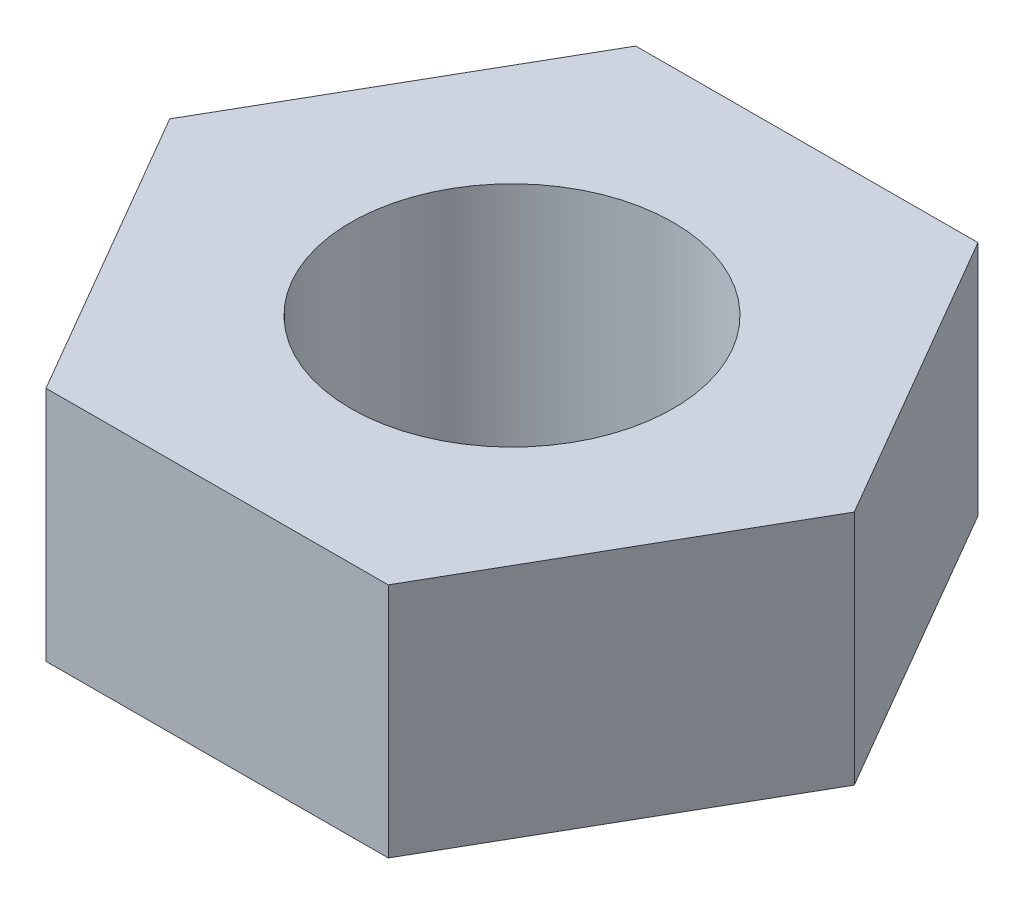
from build123d import *

# Parameters (mm, degrees)
SKETCH1_R           = 1.5
BOSS_EXTRUDE1_DEPTH = 2.2


with BuildPart() as part:
    # Sketch1 → Boss-Extrude1 (new body)
    with BuildSketch(Plane(origin=(0, 0, 0), x_dir=(1, 0, 0), z_dir=(0, 1, 0))):
        Polygon((1.580550202, 2.754123162), (-1.594865523, 2.745858208), (-3.175415725, -0.008264955), (-1.580550202, -2.754123162), (1.594865523, -2.745858208), (3.175415725, 0.008264955), align=None)
        with Locations(Location((0, 0, 0), (0, 0, 270))):
            Circle(SKETCH1_R, mode=Mode.SUBTRACT)
    extrude(amount=BOSS_EXTRUDE1_DEPTH)


solid = part.part
